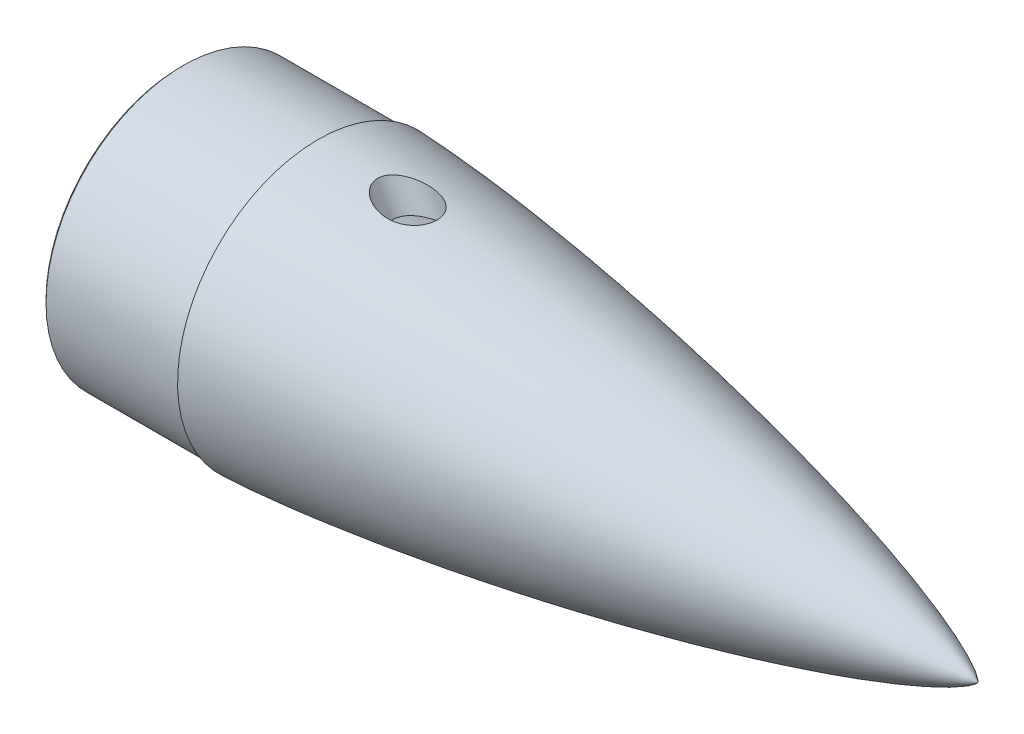
from build123d import *

# Parameters (mm, degrees)
CHAMFER1_SIZE      = 1.5
CIRPATTERN1_COUNT  = 6
SKETCH26_R         = 15
CUT_EXTRUDE5_DEPTH = 50
CUT_EXTRUDE6_START = 50
SKETCH26_2_R       = 15
CUT_EXTRUDE6_DEPTH = 50


with BuildPart() as part:
    # Sketch10 → Revolve1 (revolve)
    with BuildSketch(Plane.XY):
        with BuildLine():
            Line((11.112493743, 81.99983), (11.112493743, 67.49983))
            Line((11.112493743, 67.49983), (129.304508698, 67.49983))
            add(Edge.make_bspline(
                [(368.967251823, 0), (368.965299543, 0.012338489), (368.959416882, 0.036518378), (368.940636147, 0.082964007), (368.902304552, 0.158736421), (368.845538097, 0.250270687), (368.755690124, 0.376555746), (368.616653262, 0.54835284), (368.392888737, 0.793577299), (368.008659121, 1.164904965), (367.344738263, 1.729853685), (366.176060796, 2.601559154), (364.09282389, 3.960032328), (360.425978756, 6.040734396), (354.402196649, 9.01831007), (344.042994901, 13.507695011), (329.152005398, 19.128483965), (310.425167902, 25.398569259), (288.741266406, 31.933693508), (266.378532845, 38.106125474), (243.901379123, 43.846895186), (221.331994001, 49.212017941), (198.683967629, 54.234500927), (175.966897581, 58.934255644), (156.034567874, 62.771715365), (141.509051931, 65.395628269), (132.679425236, 66.924517444), (129.562757302, 67.455859883), (129.304508698, 67.49983)],
                knots=[0, 0, 0, 0, 0, 0.000134949, 0.000269899, 0.000539798, 0.000919537, 0.001299277, 0.001947431, 0.00293136, 0.004511869, 0.007081312, 0.011380263, 0.018707867, 0.031423867, 0.052705479, 0.084103008, 0.140910136, 0.203703492, 0.266497064, 0.329290816, 0.392084375, 0.454877964, 0.517671564, 0.580465191, 0.643258828, 0.674655593, 0.677492072, 0.677492072, 0.677492072, 0.677492072, 0.677492072], degree=4))
            Line((368.967251823, 0), (408.967251823, 0))
            add(Edge.make_bspline(
                [(408.967251823, 0), (408.964913524, 0.013501739), (408.958040758, 0.039916077), (408.936520441, 0.090485698), (408.892222076, 0.174057132), (408.826281575, 0.275556803), (408.721696416, 0.415833756), (408.561101809, 0.605075245), (408.30561918, 0.87242415), (407.86966713, 1.275299562), (407.120955138, 1.885142115), (405.803773451, 2.82590185), (403.46240692, 4.287152794), (399.325294488, 6.531818454), (392.481146888, 9.758904649), (380.662076725, 14.628008466), (363.637187185, 20.711720382), (342.215241093, 27.476512989), (317.428462321, 34.49762647), (291.879335737, 41.10482439), (266.21046092, 47.228993169), (240.44548836, 52.933436777), (214.598861982, 58.255439009), (188.68089566, 63.217582693), (165.946174917, 67.253280679), (146.421982586, 70.493799722), (130.127893898, 73.044947468), (117.078590637, 74.994157933), (104.015464216, 76.84854079), (92.573263959, 78.384492045), (82.757139441, 79.635603973), (74.571340184, 80.632219902), (68.019260454, 81.400804211), (61.463723364, 82.139375899), (54.90469802, 82.84637726), (48.342159918, 83.519940506), (41.776057559, 84.15778717), (36.02754108, 84.682157239), (31.097921259, 85.105234912), (26.988317923, 85.438669825), (23.699666618, 85.693218594), (20.085807822, 85.958448038), (16.719873821, 86.189018485), (13.602098287, 86.386966779), (10.732704013, 86.554575744), (8.436635008, 86.678703291), (6.139997341, 86.792157585), (4.129892063, 86.879313264), (2.40653858, 86.944618982), (1.257348635, 86.979022496), (0.68269791, 86.99491462), (0.395312527, 86.99983)],
                knots=[0, 0, 0, 0, 0, 0.000130123, 0.000260245, 0.000520491, 0.000900391, 0.00128029, 0.001925099, 0.002881508, 0.004418208, 0.006927086, 0.011110697, 0.018279138, 0.03067276, 0.051704469, 0.08310228, 0.139908797, 0.202702513, 0.265496165, 0.328289682, 0.391083359, 0.453876973, 0.516670577, 0.579464197, 0.642257765, 0.673654596, 0.705051427, 0.736448267, 0.767845106, 0.799241874, 0.814940257, 0.830638641, 0.846337073, 0.862035505, 0.877733936, 0.893432368, 0.90913072, 0.924829072, 0.932678248, 0.940527424, 0.9483766, 0.956225776, 0.967169332, 0.97264111, 0.978112888, 0.983584666, 0.989056444, 0.994528222, 0.997264111, 1, 1, 1, 1, 1], degree=4))
            Line((0.395312527, 86.99983), (0.395312527, 84.99983))
            Line((0.395312527, 84.99983), (-84.604517473, 84.99983))
            Line((-84.604517473, 84.99983), (-84.604517473, 81.99983))
            Line((-84.604517473, 81.99983), (11.112493743, 81.99983))
        make_face()
    revolve(axis=Axis((46.917858469, 0, 0), (-1, 0, 0)))

    # Chamfer1
    chamfer1_edges = [part.edges().sort_by_distance(p)[0] for p in [
        (-84.604517473, -84.99983, 0),
    ]]
    chamfer(chamfer1_edges, length=CHAMFER1_SIZE)

    # Sketch18 → Tapped Hole for M4x0.7 Helicoil1 (revolve, cut)
    with BuildSketch(Plane(origin=(11.112493743, 64.735251709, -37.374915), x_dir=(0, 0, 1), z_dir=(0, 1, 0))):
        Polygon((0, 0), (0, 31.2618073), (2.1, 30), (2.1, 0), align=None)
    tapped_hole_for_m4x0_7_helicoil1 = revolve(axis=Axis((4.762493743, 64.735251709, -37.374915), (1, 0, 0)), mode=Mode.SUBTRACT)

    # CirPattern1: Tapped Hole for M4x0.7 Helicoil1 ×6 about axis
    cirpattern1_axis = Axis((11.112493743, 0, 0), (1, 0, 0))
    for i in range(1, CIRPATTERN1_COUNT):
        add(tapped_hole_for_m4x0_7_helicoil1.rotate(cirpattern1_axis, i * 360 / CIRPATTERN1_COUNT), mode=Mode.SUBTRACT)

    # Sketch26 → Cut-Extrude5 (cut)
    with BuildSketch(Plane(origin=(-16.431060981, 28.459432441, 0), x_dir=(0, 0, 1), z_dir=(-0.500000000000001, 0.866025403784438, 0))):
        with Locations((0, 89.525578438)):
            Circle(SKETCH26_R)
    extrude(amount=-CUT_EXTRUDE5_DEPTH, mode=Mode.SUBTRACT)

    # Sketch26<2> → Cut-Extrude6 (cut)
    with BuildSketch(Plane(origin=(-16.431060981, 28.459432441, 0), x_dir=(0, 0, 1), z_dir=(-0.500000000000001, 0.866025403784438, 0)).offset(CUT_EXTRUDE6_START)):
        with Locations((0, 89.525578438)):
            Circle(SKETCH26_2_R)
    extrude(amount=-CUT_EXTRUDE6_DEPTH, mode=Mode.SUBTRACT)


solid = part.part
